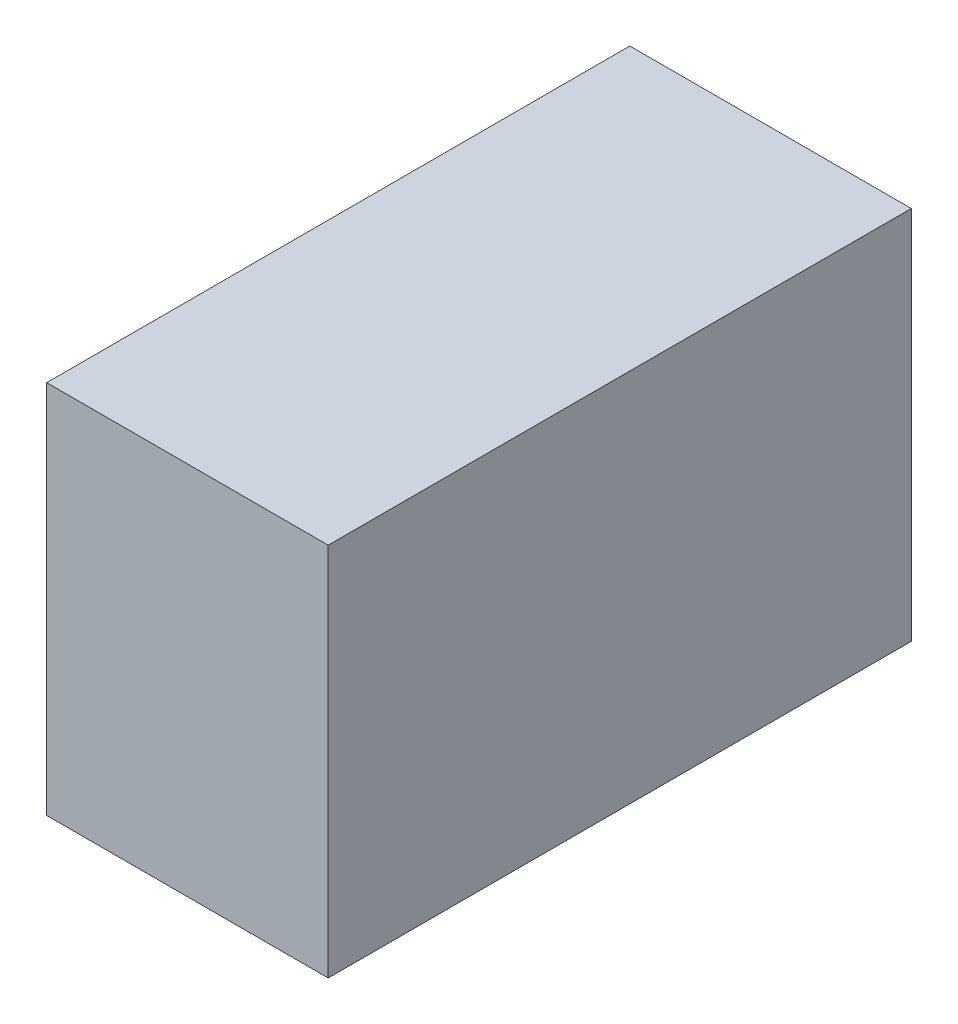
from build123d import *

# Parameters (mm, degrees)
SKETCH1_W           = 19.6
SKETCH1_H           = 40.6
BOSS_EXTRUDE1_DEPTH = 26.1


with BuildPart() as part:
    # Sketch1 → Boss-Extrude1 (new body)
    with BuildSketch(Plane(origin=(0, 0, 0), x_dir=(1, 0, 0), z_dir=(0, 1, 0))):
        Rectangle(SKETCH1_W, SKETCH1_H)
    extrude(amount=BOSS_EXTRUDE1_DEPTH)


solid = part.part
